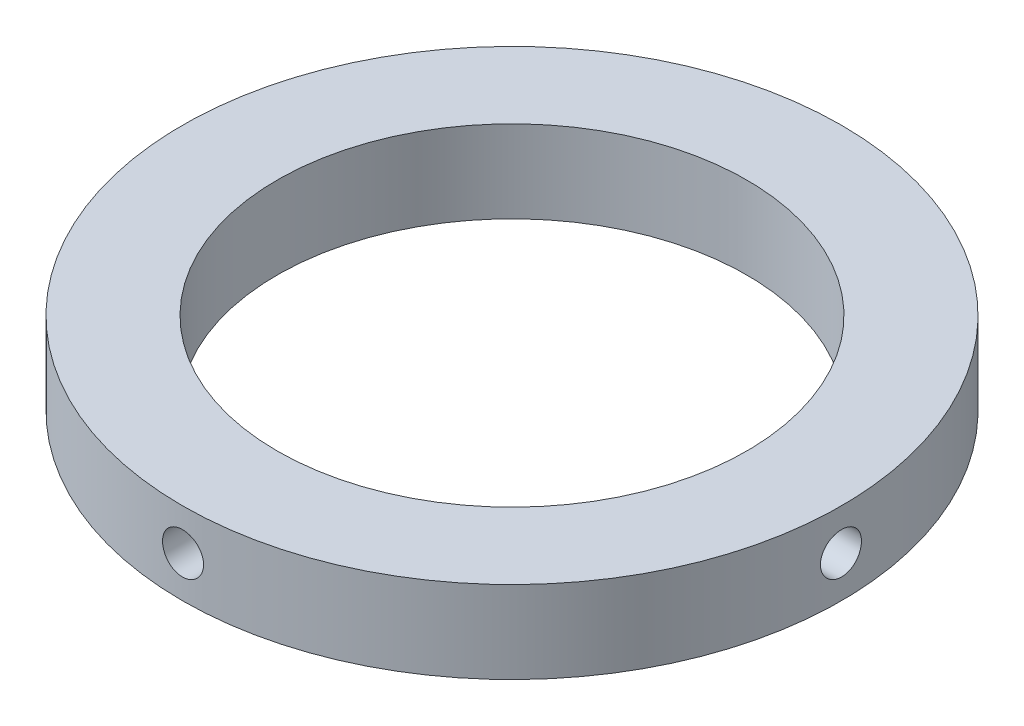
from build123d import *

# Parameters (mm, degrees)
SKETCH1_W          = 10.9728
SKETCH1_H          = 9.525
SKETCH2_R          = 2.3749
CUT_EXTRUDE1_DEPTH = 6.35
CIRPATTERN1_COUNT  = 4


with BuildPart() as part:
    # Sketch1 → Revolve1 (revolve)
    with BuildSketch(Plane.XY):
        with Locations((32.6644, -4.7625)):
            Rectangle(SKETCH1_W, SKETCH1_H)
    revolve(axis=Axis((0, 22.709640493, 0), (0, -1, 0)))

    # Sketch2 → Cut-Extrude1 (cut)
    with BuildSketch(Plane.ZY.offset(38.1508)):
        with Locations((0, -4.7625)):
            Circle(SKETCH2_R)
    cut_extrude1 = extrude(amount=-CUT_EXTRUDE1_DEPTH, mode=Mode.SUBTRACT)

    # CirPattern1: Cut-Extrude1 ×4 about axis
    cirpattern1_axis = Axis((0, -10.00125, 0), (0, 1, 0))
    for i in range(1, CIRPATTERN1_COUNT):
        add(cut_extrude1.rotate(cirpattern1_axis, i * 360 / CIRPATTERN1_COUNT), mode=Mode.SUBTRACT)


solid = part.part
